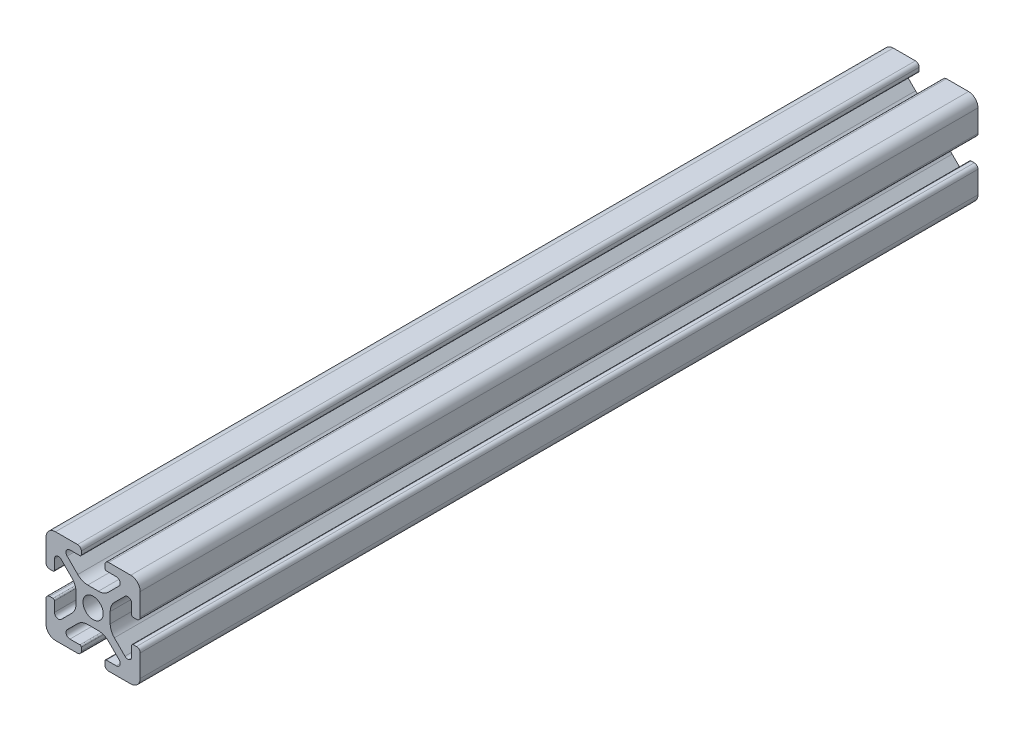
from build123d import *

# Parameters (mm, degrees)
SKETCH1_R           = 2.1463
BOSS_EXTRUDE1_DEPTH = 88.9


with BuildPart() as part:
    # Sketch1 → Boss-Extrude1 (new, symmetric)
    with BuildSketch(Plane.XY):
        with BuildLine():
            Line((-9.9949, 7.9883), (-9.9949, 3.2893))
            ThreePointArc((-9.9949, 3.2893), (-9.76427588, 2.73252412), (-9.2075, 2.5019))
            Line((-9.2075, 2.5019), (-8.4963, 2.5019))
            ThreePointArc((-8.4963, 2.5019), (-8.280773853, 2.591173853), (-8.1915, 2.8067))
            Line((-8.1915, 2.8067), (-8.1915, 4.9149))
            ThreePointArc((-8.1915, 4.9149), (-7.674065253, 5.689295824), (-6.760603096, 5.507596904))
            Line((-6.760603096, 5.507596904), (-4.505765747, 3.252759555))
            ThreePointArc((-4.505765747, 3.252759555), (-3.856054457, 2.280397894), (-3.627906192, 1.133419111))
            Line((-3.627906192, 1.133419111), (-3.627906192, -1.133419111))
            ThreePointArc((-3.627906192, -1.133419111), (-3.856054457, -2.280397894), (-4.505765747, -3.252759555))
            Line((-4.505765747, -3.252759555), (-6.760603096, -5.507596904))
            ThreePointArc((-6.760603096, -5.507596904), (-7.674065253, -5.689295824), (-8.1915, -4.9149))
            Line((-8.1915, -4.9149), (-8.1915, -2.8067))
            ThreePointArc((-8.1915, -2.8067), (-8.280773853, -2.591173853), (-8.4963, -2.5019))
            Line((-8.4963, -2.5019), (-9.2075, -2.5019))
            ThreePointArc((-9.2075, -2.5019), (-9.76427588, -2.73252412), (-9.9949, -3.2893))
            Line((-9.9949, -3.2893), (-9.9949, -7.9883))
            ThreePointArc((-9.9949, -7.9883), (-9.407180467, -9.407180467), (-7.9883, -9.9949))
            Line((-7.9883, -9.9949), (-3.2893, -9.9949))
            ThreePointArc((-3.2893, -9.9949), (-2.73252412, -9.76427588), (-2.5019, -9.2075))
            Line((-2.5019, -9.2075), (-2.5019, -8.4963))
            ThreePointArc((-2.5019, -8.4963), (-2.591173853, -8.280773853), (-2.8067, -8.1915))
            Line((-2.8067, -8.1915), (-4.9149, -8.1915))
            ThreePointArc((-4.9149, -8.1915), (-5.689295824, -7.674065253), (-5.507596904, -6.760603096))
            Line((-5.507596904, -6.760603096), (-3.252759555, -4.505765747))
            ThreePointArc((-3.252759555, -4.505765747), (-2.280397894, -3.856054457), (-1.133419111, -3.627906192))
            Line((-1.133419111, -3.627906192), (1.133419111, -3.627906192))
            ThreePointArc((1.133419111, -3.627906192), (2.280397894, -3.856054457), (3.252759555, -4.505765747))
            Line((3.252759555, -4.505765747), (5.507596904, -6.760603096))
            ThreePointArc((5.507596904, -6.760603096), (5.689295824, -7.674065253), (4.9149, -8.1915))
            Line((4.9149, -8.1915), (2.8067, -8.1915))
            ThreePointArc((2.8067, -8.1915), (2.591173853, -8.280773853), (2.5019, -8.4963))
            Line((2.5019, -8.4963), (2.5019, -9.2075))
            ThreePointArc((2.5019, -9.2075), (2.73252412, -9.76427588), (3.2893, -9.9949))
            Line((3.2893, -9.9949), (7.9883, -9.9949))
            ThreePointArc((7.9883, -9.9949), (9.407180467, -9.407180467), (9.9949, -7.9883))
            Line((9.9949, -7.9883), (9.9949, -3.2893))
            ThreePointArc((9.9949, -3.2893), (9.76427588, -2.73252412), (9.2075, -2.5019))
            Line((9.2075, -2.5019), (8.4963, -2.5019))
            ThreePointArc((8.4963, -2.5019), (8.280773853, -2.591173853), (8.1915, -2.8067))
            Line((8.1915, -2.8067), (8.1915, -4.9149))
            ThreePointArc((8.1915, -4.9149), (7.674065253, -5.689295824), (6.760603096, -5.507596904))
            Line((6.760603096, -5.507596904), (4.505765747, -3.252759555))
            ThreePointArc((4.505765747, -3.252759555), (3.856054457, -2.280397894), (3.627906192, -1.133419111))
            Line((3.627906192, -1.133419111), (3.627906192, 1.133419111))
            ThreePointArc((3.627906192, 1.133419111), (3.856054457, 2.280397894), (4.505765747, 3.252759555))
            Line((4.505765747, 3.252759555), (6.760603096, 5.507596904))
            ThreePointArc((6.760603096, 5.507596904), (7.674065253, 5.689295824), (8.1915, 4.9149))
            Line((8.1915, 4.9149), (8.1915, 2.8067))
            ThreePointArc((8.1915, 2.8067), (8.280773853, 2.591173853), (8.4963, 2.5019))
            Line((8.4963, 2.5019), (9.2075, 2.5019))
            ThreePointArc((9.2075, 2.5019), (9.76427588, 2.73252412), (9.9949, 3.2893))
            Line((9.9949, 3.2893), (9.9949, 7.9883))
            ThreePointArc((9.9949, 7.9883), (9.407180467, 9.407180467), (7.9883, 9.9949))
            Line((7.9883, 9.9949), (3.2893, 9.9949))
            ThreePointArc((3.2893, 9.9949), (2.73252412, 9.76427588), (2.5019, 9.2075))
            Line((2.5019, 9.2075), (2.5019, 8.4963))
            ThreePointArc((2.5019, 8.4963), (2.591173853, 8.280773853), (2.8067, 8.1915))
            Line((2.8067, 8.1915), (4.9149, 8.1915))
            ThreePointArc((4.9149, 8.1915), (5.689295824, 7.674065253), (5.507596904, 6.760603096))
            Line((5.507596904, 6.760603096), (3.252759555, 4.505765747))
            ThreePointArc((3.252759555, 4.505765747), (2.280397894, 3.856054457), (1.133419111, 3.627906192))
            Line((1.133419111, 3.627906192), (-1.133419111, 3.627906192))
            ThreePointArc((-1.133419111, 3.627906192), (-2.280397894, 3.856054457), (-3.252759555, 4.505765747))
            Line((-3.252759555, 4.505765747), (-5.507596904, 6.760603096))
            ThreePointArc((-5.507596904, 6.760603096), (-5.689295824, 7.674065253), (-4.9149, 8.1915))
            Line((-4.9149, 8.1915), (-2.8067, 8.1915))
            ThreePointArc((-2.8067, 8.1915), (-2.591173853, 8.280773853), (-2.5019, 8.4963))
            Line((-2.5019, 8.4963), (-2.5019, 9.2075))
            ThreePointArc((-2.5019, 9.2075), (-2.73252412, 9.76427588), (-3.2893, 9.9949))
            Line((-3.2893, 9.9949), (-7.9883, 9.9949))
            ThreePointArc((-7.9883, 9.9949), (-9.407180467, 9.407180467), (-9.9949, 7.9883))
        make_face()
        Circle(SKETCH1_R, mode=Mode.SUBTRACT)
    extrude(amount=BOSS_EXTRUDE1_DEPTH, both=True)


solid = part.part
